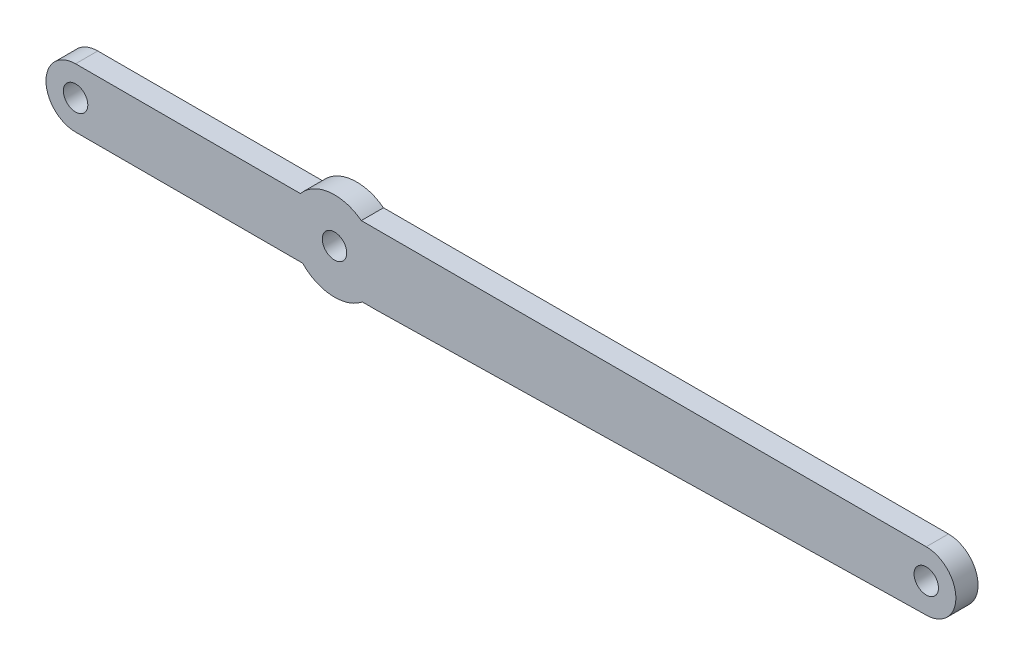
from build123d import *

# Parameters (mm, degrees)
EXTRUDE_1_DEPTH     = 3
SKETCH_2_R          = 1.35
CUT_EXTRUDE_1_DEPTH = 2.444444444
SKETCH_3_R          = 1.65
CUT_EXTRUDE_3_DEPTH = 96.756657889
CUT_EXTRUDE_4_DEPTH = 1


with BuildPart() as part:
    # 草图1 → 凸台-拉伸1 (new body)
    with BuildSketch(Plane.XY.offset(3)):
        with BuildLine():
            Line((-60.832535173, 7.514094179), (-91.218664305, 7.514094179))
            ThreePointArc((-91.218664305, 7.514094179), (-95.218664305, 3.514094179), (-91.218664305, -0.485905821))
            Line((-91.218664305, -0.485905821), (-60.531573746, -0.485905821))
            ThreePointArc((-60.531573746, -0.485905821), (-56.589491156, -2.306217172), (-52.451603626, -0.990377005))
            Line((-52.451603626, -0.990377005), (-50.420982545, -0.990377005))
            Line((-50.420982545, -0.990377005), (23.816560918, 0.467808699))
            Line((23.816560918, 0.467808699), (23.856567982, 0.468594524))
            ThreePointArc((23.856567982, 0.468594524), (27.777723532, 4.507000717), (23.778016459, 8.467622986))
            Line((23.778016459, 8.467622986), (-52.596358319, 8.467622986))
            ThreePointArc((-52.596358319, 8.467622986), (-56.905640848, 9.642312032), (-60.832535173, 7.514094179))
        make_face()
    extrude(amount=-EXTRUDE_1_DEPTH)

    # 草图2 → 切除-拉伸1 (cut)
    with BuildSketch(Plane.XY.offset(3)):
        with Locations(Location((23.77801746, 4.467622995, 0), (0, 0, 180))):
            Circle(SKETCH_2_R)
    extrude(amount=-CUT_EXTRUDE_1_DEPTH, mode=Mode.SUBTRACT)

    # 草图3 → 切除-拉伸3 (cut, through all)
    with BuildSketch(Plane(origin=(0, 0, 0), x_dir=(-1, 0, 0), z_dir=(0, 0, -1))):
        with Locations(Location((-23.778017455, 4.467823177, 0), (0, 0, 180))):
            Circle(SKETCH_3_R)
        with Locations((56.215610459, 3.6821226)):
            Circle(SKETCH_3_R)
        with Locations((91.218664305, 3.514094179)):
            Circle(SKETCH_3_R)
    extrude(amount=-CUT_EXTRUDE_3_DEPTH, mode=Mode.SUBTRACT)

    # 草图4 → 切除-拉伸4 (cut)
    with BuildSketch(Plane(origin=(0, 0, 0), x_dir=(-1, 0, 0), z_dir=(0, 0, -1))):
        with BuildLine():
            Line((80.04205053, 5.564500073), (80.04205053, 5.205525714))
            Line((80.04205053, 5.205525714), (78.851545722, 5.205525714))
            Line((78.851545722, 5.205525714), (78.662943959, 4.284952797))
            add(Edge.make_bspline(
                [(78.662943959, 4.284952797), (78.699999834, 4.295183069), (78.77178973, 4.315002603), (78.877749591, 4.337008373), (78.978341794, 4.350273817), (79.043617164, 4.352085128), (79.075203575, 4.352961612)],
                knots=[0, 0, 0, 0, 1.100273476, 2.13160584, 3.095893838, 4, 4, 4, 4], degree=3))
            add(Edge.make_bspline(
                [(79.075203575, 4.352961612), (79.114287314, 4.352115676), (79.191135712, 4.350452355), (79.303574659, 4.334480505), (79.410907552, 4.309340591), (79.512909922, 4.274220069), (79.609770473, 4.229310336), (79.700598034, 4.173210396), (79.786755947, 4.107677064), (79.866698541, 4.032332052), (79.939222849, 3.949410436), (80.002988839, 3.860252565), (80.057151429, 3.765724903), (80.100712184, 3.664924294), (80.135496519, 3.55896514), (80.158648513, 3.446732558), (80.174065222, 3.329284438), (80.175787609, 3.248979868), (80.176665915, 3.208029721)],
                knots=[0, 0, 0, 0, 1.052922333, 2.070308379, 3.05430497, 4.020497103, 4.973039431, 5.925935799, 6.892292201, 7.88610001, 8.88166317, 9.857072816, 10.836096531, 11.812156883, 12.81219415, 13.836441305, 14.89672472, 16, 16, 16, 16], degree=3))
            add(Edge.make_bspline(
                [(80.176665915, 3.208029721), (80.176000839, 3.1795075), (80.174679677, 3.122848513), (80.167961089, 3.038704312), (80.155025373, 2.956341479), (80.137657649, 2.875749087), (80.115115231, 2.797079715), (80.087826177, 2.720108187), (80.054430149, 2.64531358), (80.017798774, 2.571988185), (79.976552296, 2.501789678), (79.930773789, 2.436140691), (79.882408298, 2.37405641), (79.830366912, 2.316202677), (79.774165917, 2.262959659), (79.71448595, 2.214011377), (79.651803231, 2.168530047), (79.585147989, 2.128361852), (79.516005506, 2.091398896), (79.443377289, 2.061075359), (79.368916588, 2.03396483), (79.291551713, 2.012355303), (79.2114579, 1.995422748), (79.128503125, 1.983922148), (79.043122455, 1.97554571), (78.985247442, 1.975021353), (78.95601287, 1.974756483)],
                knots=[0, 0, 0, 0, 1.056347294, 2.098418968, 3.122841568, 4.141288669, 5.149314143, 6.15115421, 7.162517403, 8.180376062, 9.185164535, 10.17417709, 11.141909838, 12.097768115, 13.052685741, 14.0056014, 14.954263652, 15.917497458, 16.885230207, 17.854509472, 18.828990115, 19.81800267, 20.826176721, 21.857883937, 22.917946725, 24, 24, 24, 24], degree=3))
            add(Edge.make_bspline(
                [(78.95601287, 1.974756483), (78.921138689, 1.975447321), (78.852527858, 1.976806463), (78.752007291, 1.991024949), (78.655292685, 2.011388865), (78.563162584, 2.042025135), (78.474791321, 2.08041243), (78.391368603, 2.128928601), (78.310762827, 2.183907705), (78.23625079, 2.248788058), (78.167094677, 2.31970374), (78.105188168, 2.396661381), (78.050054591, 2.478390823), (78.002576844, 2.565288977), (77.962078823, 2.657127508), (77.930263834, 2.754250509), (77.904585479, 2.856150513), (77.893722059, 2.926304023), (77.888204376, 2.961935971)],
                knots=[0, 0, 0, 0, 1.0467383, 2.05933395, 3.04377827, 4.011590433, 4.970194871, 5.932262533, 6.905835911, 7.896367577, 8.894135286, 9.877477877, 10.858688626, 11.851381753, 12.8477658, 13.868841284, 14.917554742, 16, 16, 16, 16], degree=3))
            Line((77.888204376, 2.961935971), (78.20230694, 2.961935971))
            add(Edge.make_bspline(
                [(78.20230694, 2.961935971), (78.210035498, 2.928559518), (78.224890214, 2.864408123), (78.257495963, 2.774276782), (78.297361838, 2.693957558), (78.344766187, 2.622387975), (78.401316217, 2.559978978), (78.465845646, 2.504361916), (78.538193369, 2.454186786), (78.618586599, 2.412364019), (78.703399678, 2.376695266), (78.792166888, 2.352943571), (78.882471235, 2.336242678), (78.943549605, 2.334570917), (78.974242036, 2.333730842)],
                knots=[0, 0, 0, 0, 1.136247022, 2.183929868, 3.172523383, 4.106158343, 5.02341133, 5.958108904, 6.928429099, 7.938127109, 8.96079061, 9.975095812, 10.982467395, 12, 12, 12, 12], degree=3))
            add(Edge.make_bspline(
                [(78.974242036, 2.333730842), (79.004200481, 2.33455162), (79.063188903, 2.336167739), (79.15000029, 2.348606751), (79.233813164, 2.367764322), (79.313800521, 2.396434177), (79.39136206, 2.431278895), (79.464535831, 2.475993971), (79.535438708, 2.52745399), (79.601866841, 2.58641062), (79.662706291, 2.651380314), (79.716462412, 2.720857708), (79.761239325, 2.794974554), (79.798973434, 2.872447707), (79.827626733, 2.954126264), (79.848067714, 3.03962744), (79.860070773, 3.12916242), (79.861721953, 3.19023173), (79.86256335, 3.221351035)],
                knots=[0, 0, 0, 0, 1.027316725, 2.022795036, 3.002884548, 3.971462791, 4.93288096, 5.914575861, 6.907176829, 7.935150275, 8.956128384, 9.956726525, 10.942570165, 11.921478529, 12.907843606, 13.90538589, 14.932640048, 16, 16, 16, 16], degree=3))
            add(Edge.make_bspline(
                [(79.86256335, 3.221351035), (79.861904871, 3.249426786), (79.860615991, 3.304381075), (79.850085421, 3.384780282), (79.831768448, 3.460853324), (79.806344569, 3.532967558), (79.774065061, 3.601191), (79.734618748, 3.665594061), (79.687265351, 3.725327894), (79.633173462, 3.780420447), (79.573915421, 3.831265322), (79.508471678, 3.874609409), (79.438211752, 3.911073326), (79.363982152, 3.942541325), (79.284017254, 3.96514207), (79.199900621, 3.982109956), (79.110723913, 3.991925318), (79.049753225, 3.993287207), (79.018412709, 3.993987253)],
                knots=[0, 0, 0, 0, 1.045622112, 2.046656509, 3.013763289, 3.955457236, 4.890082067, 5.820317437, 6.762574623, 7.722996705, 8.69280354, 9.665887285, 10.63943826, 11.638615906, 12.663482002, 13.728887084, 14.832589034, 16, 16, 16, 16], degree=3))
            add(Edge.make_bspline(
                [(79.018412709, 3.993987253), (78.991283781, 3.993406661), (78.935269425, 3.992207888), (78.849346599, 3.983381391), (78.759054876, 3.969142097), (78.66474038, 3.949555849), (78.566119872, 3.923924772), (78.463401471, 3.893210272), (78.356369205, 3.856488273), (78.28425148, 3.828756059), (78.247178735, 3.814500073)],
                knots=[0, 0, 0, 0, 0.817624296, 1.688186739, 2.600797293, 3.572016777, 4.590301741, 5.671205678, 6.80286297, 8, 8, 8, 8], degree=3))
            Line((78.247178735, 3.814500073), (78.606153094, 5.564500073))
            Line((78.606153094, 5.564500073), (80.04205053, 5.564500073))
        make_face()
    extrude(amount=-CUT_EXTRUDE_4_DEPTH, mode=Mode.SUBTRACT)


solid = part.part
